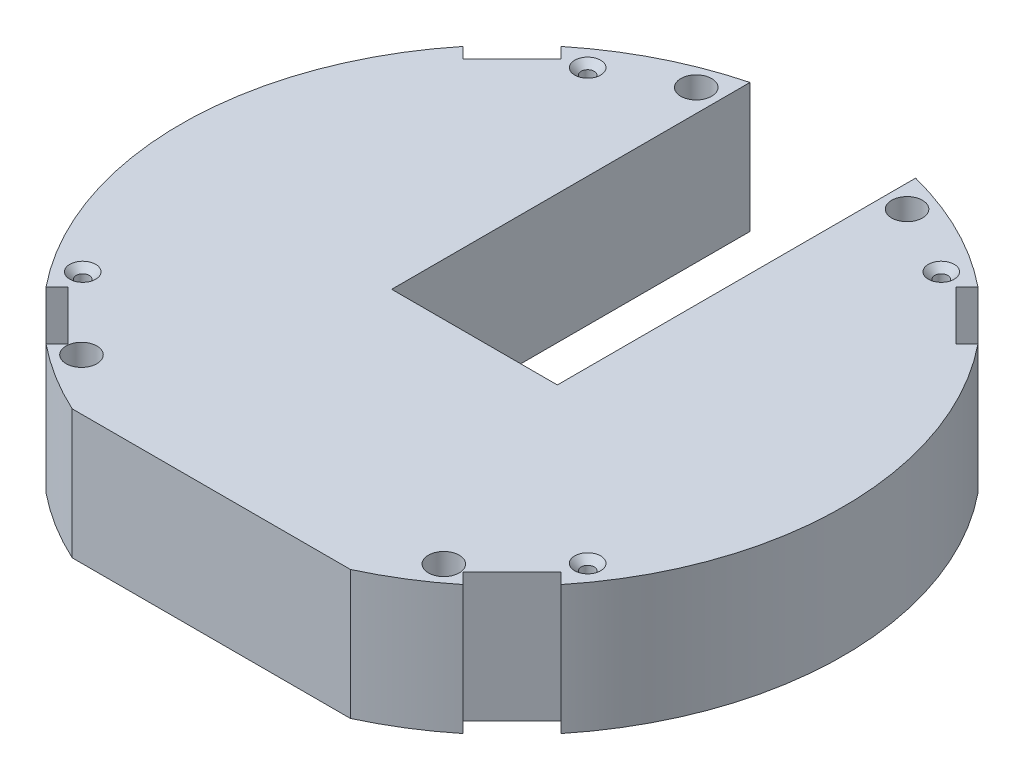
from build123d import *

# Parameters (mm, degrees)
RESSALTO_EXTRUS_O2_DEPTH             = 33.5
ESCAREADO_PARA_SFHCS_M31_D           = 3.4
ESCAREADO_PARA_SFHCS_M31_CSINK_D     = 6.72
ESCAREADO_PARA_SFHCS_M31_CSINK_ANGLE = 90
ESBO_O7_R                            = 4
CORTE_EXTRUS_O1_DEPTH                = 125.306073866
CORTE_EXTRUS_O2_DEPTH                = 125.306073866


with BuildPart() as part:
    # Esboço3 → Ressalto-extrusão2 (new body)
    with BuildSketch(Plane(origin=(0, 0, 0), x_dir=(1, 0, 0), z_dir=(0, 1, 0))):
        with BuildLine():
            Line((-21.5, 83.269141943), (-21.5, -9.730858057))
            Line((-21.5, -9.730858057), (21.5, -9.730858057))
            Line((21.5, -9.730858057), (21.5, 83.269141943))
            ThreePointArc((21.5, 83.269141943), (38.688656502, 76.806170703), (54.113307426, 66.841229488))
            Line((54.113307426, 66.841229488), (66.841229488, 54.113307426))
            ThreePointArc((66.841229488, 54.113307426), (86, 0), (66.841229488, -54.113307426))
            Line((66.841229488, -54.113307426), (54.113307426, -66.841229488))
            ThreePointArc((54.113307426, -66.841229488), (45.453875584, -73.006473647), (36.1, -78.056325817))
            Line((36.1, -78.056325817), (-36.1, -78.056325817))
            ThreePointArc((-36.1, -78.056325817), (-45.453875584, -73.006473647), (-54.113307426, -66.841229488))
            Line((-54.113307426, -66.841229488), (-66.841229488, -54.113307426))
            ThreePointArc((-66.841229488, -54.113307426), (-86, 0), (-66.841229488, 54.113307426))
            Line((-66.841229488, 54.113307426), (-54.113307426, 66.841229488))
            ThreePointArc((-54.113307426, 66.841229488), (-38.688656502, 76.806170703), (-21.5, 83.269141943))
        make_face()
    extrude(amount=RESSALTO_EXTRUS_O2_DEPTH)

    # Escareado para SFHCS M31 (through all)
    with Locations(Plane(origin=(0, 33.5, 0), x_dir=(1, 0, 0), z_dir=(0, 1, 0))):
        with Locations((45.886114908, 65.532163543), (65.532163543, -45.886114908), (-65.532163543, -45.886114908), (-45.886114908, 65.532163543)):
            CounterSinkHole(ESCAREADO_PARA_SFHCS_M31_D / 2, ESCAREADO_PARA_SFHCS_M31_CSINK_D / 2, counter_sink_angle=ESCAREADO_PARA_SFHCS_M31_CSINK_ANGLE)

    # Esboço7 → Corte-extrusão1 (cut, through all)
    with BuildSketch(Plane(origin=(0, 33.5, 0), x_dir=(1, 0, 0), z_dir=(0, 1, 0))):
        with Locations(Location((-27.361611466, 75.175409663, 0), (0, 0, 270))):
            Circle(ESBO_O7_R)
        with Locations(Location((-47.022820183, -64.72135955, 0), (0, 0, 270))):
            Circle(ESBO_O7_R)
        with Locations(Location((47.022820183, -64.72135955, 0), (0, 0, 90))):
            Circle(ESBO_O7_R)
        with Locations(Location((27.361611466, 75.175409663, 0), (0, 0, 90))):
            Circle(ESBO_O7_R)
    extrude(amount=-CORTE_EXTRUS_O1_DEPTH, mode=Mode.SUBTRACT)

    # Esboço9 → Corte-extrusão2 (cut, through all)
    with BuildSketch(Plane(origin=(0, 33.5, 0), x_dir=(1, 0, 0), z_dir=(0, 1, 0))):
        Polygon((-66.841229488, -54.113307426), (-54.113307426, -66.841229488), (-51.284880301, -64.012802363), (-64.012802363, -51.284880301), align=None)
        Polygon((51.284880301, -64.012802363), (64.012802363, -51.284880301), (66.841229488, -54.113307426), (54.113307426, -66.841229488), align=None)
        Polygon((54.113307426, 66.841229488), (51.284880301, 64.012802363), (64.012802363, 51.284880301), (66.841229488, 54.113307426), align=None)
        Polygon((-51.284880301, 64.012802363), (-64.012802363, 51.284880301), (-66.841229488, 54.113307426), (-54.113307426, 66.841229488), align=None)
    extrude(amount=-CORTE_EXTRUS_O2_DEPTH, mode=Mode.SUBTRACT)


solid = part.part
